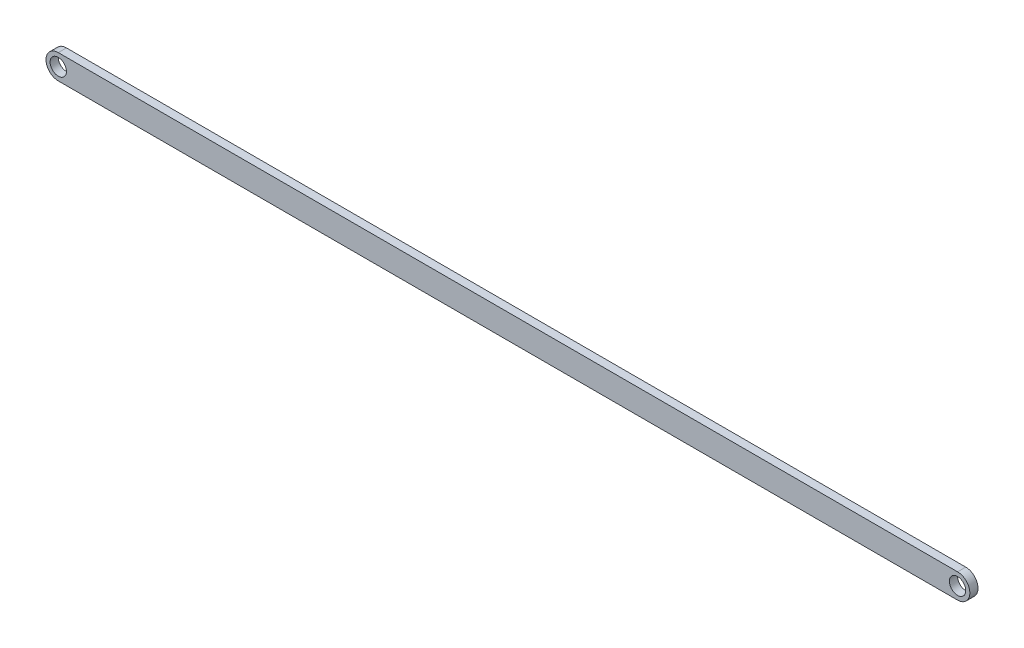
from build123d import *

# Parameters (mm, degrees)
BOSS_EXTRUDE1_DEPTH = 1
CUT_EXTRUDE2_REACH  = 113.515
SKETCH2_R           = 1


with BuildPart() as part:
    # Sketch1 → Boss-Extrude1 (new body)
    with BuildSketch(Plane.XY):
        with BuildLine():
            Line((0, 1.5), (110, 1.5))
            ThreePointArc((110, 1.5), (111.5, 0), (110, -1.5))
            Line((110, -1.5), (0, -1.5))
            ThreePointArc((0, -1.5), (-1.5, 0), (0, 1.5))
        make_face()
    extrude(amount=BOSS_EXTRUDE1_DEPTH)

    # Sketch2 → Cut-Extrude2 (cut, up to next)
    with BuildSketch(Plane.XY.offset(1), mode=Mode.PRIVATE) as cut_extrude2_sk1:
        Circle(SKETCH2_R)
    cut_extrude2_tool1 = extrude(cut_extrude2_sk1.sketch, amount=-CUT_EXTRUDE2_REACH, mode=Mode.PRIVATE) & part.part
    # Sketch2 → Cut-Extrude2 (cut, up to next)
    with BuildSketch(Plane.XY.offset(1), mode=Mode.PRIVATE) as cut_extrude2_sk2:
        with Locations((110, 0)):
            Circle(SKETCH2_R)
    cut_extrude2_tool2 = extrude(cut_extrude2_sk2.sketch, amount=-CUT_EXTRUDE2_REACH, mode=Mode.PRIVATE) & part.part
    add(cut_extrude2_tool1.solids().sort_by_distance((0, 0, 1))[0], mode=Mode.SUBTRACT)
    add(cut_extrude2_tool2.solids().sort_by_distance((110, 0, 1))[0], mode=Mode.SUBTRACT)


solid = part.part
